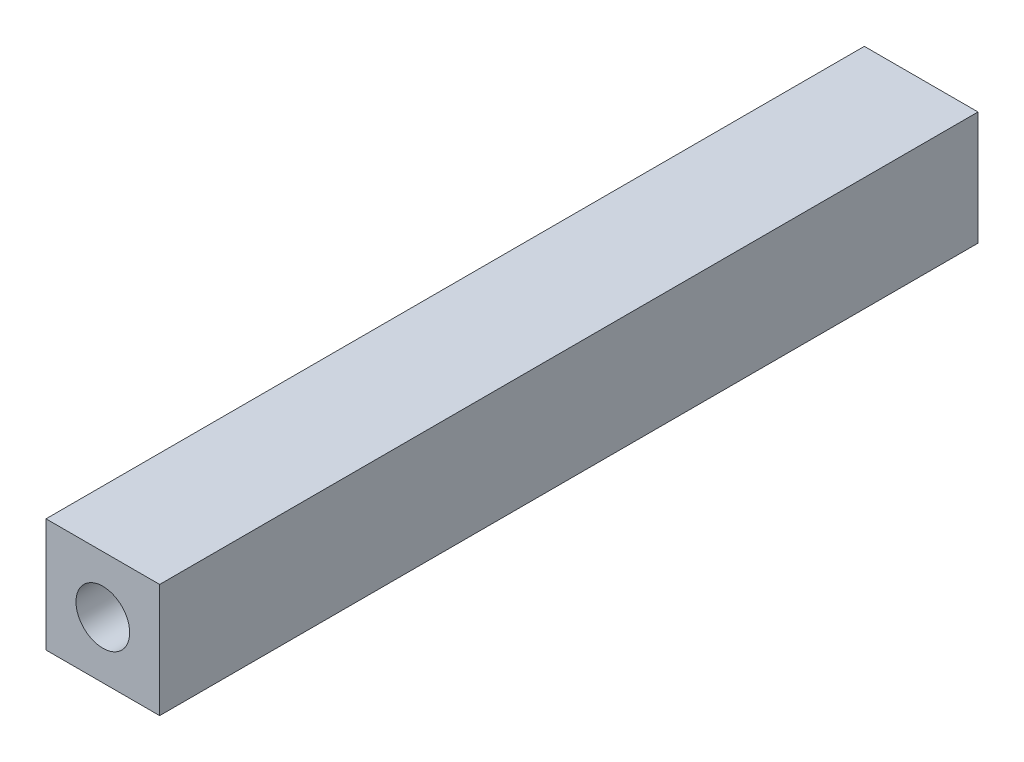
from build123d import *

# Parameters (mm, degrees)
SKETCH1_W           = 6.35
SKETCH1_H           = 6.35
SKETCH1_R           = 1.5
BOSS_EXTRUDE1_DEPTH = 45.72


with BuildPart() as part:
    # Sketch1 → Boss-Extrude1 (new body)
    with BuildSketch(Plane.XY):
        Rectangle(SKETCH1_W, SKETCH1_H)
        Circle(SKETCH1_R, mode=Mode.SUBTRACT)
    extrude(amount=BOSS_EXTRUDE1_DEPTH)


solid = part.part
